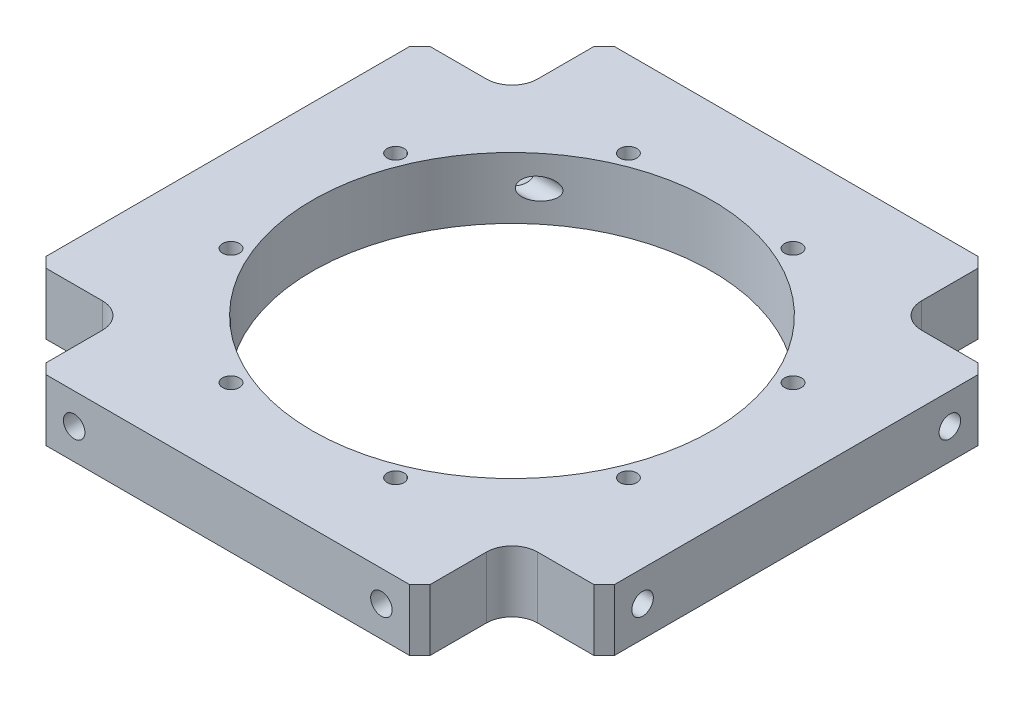
from build123d import *

# Parameters (mm, degrees)
SKETCH_1_W               = 111
SKETCH_1_H               = 111
EXTRUDE_1_DEPTH          = 12
SKETCH_2_R               = 39
CUT_EXTRUDE_1_DEPTH      = 80.400881607
HOLE_WIZARD_M4_1_D       = 3.3
PATTERN_CIRCULAR_1_COUNT = 8
SKETCH_8_W               = 36
SKETCH_8_H               = 36
CUT_EXTRUDE_2_DEPTH      = 80.400881607
FILLET_1_R               = 5
CHAMFER_1_SIZE           = 2
HOLE_WIZARD_M5_1_REACH   = 126.681
HOLE_WIZARD_M5_1_BORE_R  = 2.1
HOLE_WIZARD_M5_2_REACH   = 126.681
HOLE_WIZARD_M5_2_BORE_R  = 2.1


with BuildPart() as part:
    # 草图1 → 凸台-拉伸1 (new body)
    with BuildSketch(Plane(origin=(0, 0, 0), x_dir=(1, 0, 0), z_dir=(0, 1, 0))):
        Rectangle(SKETCH_1_W, SKETCH_1_H)
    extrude(amount=EXTRUDE_1_DEPTH)

    # 草图2 → 切除-拉伸1 (cut, through all)
    with BuildSketch(Plane(origin=(0, 12, 0), x_dir=(1, 0, 0), z_dir=(0, 1, 0))):
        with Locations(Location((0, 0, 0), (0, 0, 270))):
            Circle(SKETCH_2_R)
    extrude(amount=-CUT_EXTRUDE_1_DEPTH, mode=Mode.SUBTRACT)

    # M4 螺纹孔1 (through all)
    with Locations(Plane(origin=(0, 12, 0), x_dir=(1, 0, 0), z_dir=(0, 1, 0))):
        with Locations((-16.072704159, 38.802940365)):
            hole_wizard_m4_1 = Hole(HOLE_WIZARD_M4_1_D / 2)

    # 阵列(圆周)1: M4 螺纹孔1 ×8 about axis
    pattern_circular_1_axis = Axis((0, 0, 0), (0, 1, 0))
    for i in range(1, PATTERN_CIRCULAR_1_COUNT):
        add(hole_wizard_m4_1.rotate(pattern_circular_1_axis, i * 360 / PATTERN_CIRCULAR_1_COUNT), mode=Mode.SUBTRACT)

    # 草图8 → 切除-拉伸2 (cut, through all)
    with BuildSketch(Plane(origin=(0, 12, 0), x_dir=(1, 0, 0), z_dir=(0, 1, 0))):
        with Locations((-55.5, 55.5)):
            Rectangle(SKETCH_8_W, SKETCH_8_H)
        with Locations((55.5, 55.5)):
            Rectangle(SKETCH_8_W, SKETCH_8_H)
        with Locations((55.5, -55.5)):
            Rectangle(SKETCH_8_W, SKETCH_8_H)
        with Locations((-55.5, -55.5)):
            Rectangle(SKETCH_8_W, SKETCH_8_H)
    extrude(amount=-CUT_EXTRUDE_2_DEPTH, mode=Mode.SUBTRACT)

    # 圆角1
    fillet_1_edges = [part.edges().sort_by_distance(p)[0] for p in [
        (-37.5, 6, 37.5),
        (37.5, 6, 37.5),
        (-37.5, 6, -37.5),
        (37.5, 6, -37.5),
    ]]
    fillet(fillet_1_edges, radius=FILLET_1_R)

    # 倒角1
    chamfer_1_edges = [part.edges().sort_by_distance(p)[0] for p in [
        (-55.5, 6, 37.5),
        (-37.5, 6, 55.5),
        (37.5, 6, 55.5),
        (55.5, 6, 37.5),
        (-37.5, 6, -55.5),
        (-55.5, 6, -37.5),
        (55.5, 6, -37.5),
        (37.5, 6, -55.5),
    ]]
    chamfer(chamfer_1_edges, length=CHAMFER_1_SIZE)

    # M5 螺纹孔1 bore → M5 螺纹孔1 (cut, up to next)
    with BuildSketch(Plane.ZY.offset(55.5), mode=Mode.PRIVATE) as hole_wizard_m5_1_sk1:
        with Locations((-30, 6)):
            Circle(HOLE_WIZARD_M5_1_BORE_R)
    hole_wizard_m5_1_tool1 = extrude(hole_wizard_m5_1_sk1.sketch, amount=-HOLE_WIZARD_M5_1_REACH, mode=Mode.PRIVATE) & part.part
    # M5 螺纹孔1 bore → M5 螺纹孔1 (cut, up to next)
    with BuildSketch(Plane.ZY.offset(55.5), mode=Mode.PRIVATE) as hole_wizard_m5_1_sk2:
        with Locations((30, 6)):
            Circle(HOLE_WIZARD_M5_1_BORE_R)
    hole_wizard_m5_1_tool2 = extrude(hole_wizard_m5_1_sk2.sketch, amount=-HOLE_WIZARD_M5_1_REACH, mode=Mode.PRIVATE) & part.part
    hole_wizard_m5_1_1 = hole_wizard_m5_1_tool1.solids().sort_by_distance((-55.5, 6, -30))[0]
    add(hole_wizard_m5_1_1, mode=Mode.SUBTRACT)
    hole_wizard_m5_1_2 = hole_wizard_m5_1_tool2.solids().sort_by_distance((-55.5, 6, 30))[0]
    add(hole_wizard_m5_1_2, mode=Mode.SUBTRACT)
    hole_wizard_m5_1 = hole_wizard_m5_1_1 + hole_wizard_m5_1_2  # M5 螺纹孔1 as one shape, for the pattern or mirror that repeats it

    # M5 螺纹孔2 bore → M5 螺纹孔2 (cut, up to next)
    with BuildSketch(Plane(origin=(0, 0, -55.5), x_dir=(-1, 0, 0), z_dir=(0, 0, -1)), mode=Mode.PRIVATE) as hole_wizard_m5_2_sk1:
        with Locations((-30, 6)):
            Circle(HOLE_WIZARD_M5_2_BORE_R)
    hole_wizard_m5_2_tool1 = extrude(hole_wizard_m5_2_sk1.sketch, amount=-HOLE_WIZARD_M5_2_REACH, mode=Mode.PRIVATE) & part.part
    # M5 螺纹孔2 bore → M5 螺纹孔2 (cut, up to next)
    with BuildSketch(Plane(origin=(0, 0, -55.5), x_dir=(-1, 0, 0), z_dir=(0, 0, -1)), mode=Mode.PRIVATE) as hole_wizard_m5_2_sk2:
        with Locations((30, 6)):
            Circle(HOLE_WIZARD_M5_2_BORE_R)
    hole_wizard_m5_2_tool2 = extrude(hole_wizard_m5_2_sk2.sketch, amount=-HOLE_WIZARD_M5_2_REACH, mode=Mode.PRIVATE) & part.part
    hole_wizard_m5_2_1 = hole_wizard_m5_2_tool1.solids().sort_by_distance((30, 6, -55.5))[0]
    add(hole_wizard_m5_2_1, mode=Mode.SUBTRACT)
    hole_wizard_m5_2_2 = hole_wizard_m5_2_tool2.solids().sort_by_distance((-30, 6, -55.5))[0]
    add(hole_wizard_m5_2_2, mode=Mode.SUBTRACT)
    hole_wizard_m5_2 = hole_wizard_m5_2_1 + hole_wizard_m5_2_2  # M5 螺纹孔2 as one shape, for the pattern or mirror that repeats it

    # 镜向1: M5 螺纹孔2 across plane
    add(hole_wizard_m5_2.mirror(Plane.XY), mode=Mode.SUBTRACT)

    # 镜向2: M5 螺纹孔1 mirrored; each copy of M5 螺纹孔1 runs up to whatever stops it at its own place
    mirror_2_before = part.part  # the part as the pattern finds it: every copy runs up to it
    mirror_2_hole_wizard_m5_1_long1 = extrude(hole_wizard_m5_1_sk1.sketch, amount=-HOLE_WIZARD_M5_1_REACH, mode=Mode.PRIVATE)
    mirror_2_hole_wizard_m5_1_long2 = extrude(hole_wizard_m5_1_sk2.sketch, amount=-HOLE_WIZARD_M5_1_REACH, mode=Mode.PRIVATE)
    mirror_2_hole_wizard_m5_1_tool1_1 = mirror_2_hole_wizard_m5_1_long1.mirror(Plane(origin=(0, 0, 0), x_dir=(0, 0, 1), z_dir=(1, 0, 0))) & mirror_2_before
    add(mirror_2_hole_wizard_m5_1_tool1_1.solids().sort_by_distance((55.5, 6, -30))[0], mode=Mode.SUBTRACT)
    mirror_2_hole_wizard_m5_1_tool2_1 = mirror_2_hole_wizard_m5_1_long2.mirror(Plane(origin=(0, 0, 0), x_dir=(0, 0, 1), z_dir=(1, 0, 0))) & mirror_2_before
    add(mirror_2_hole_wizard_m5_1_tool2_1.solids().sort_by_distance((55.5, 6, 30))[0], mode=Mode.SUBTRACT)


solid = part.part
